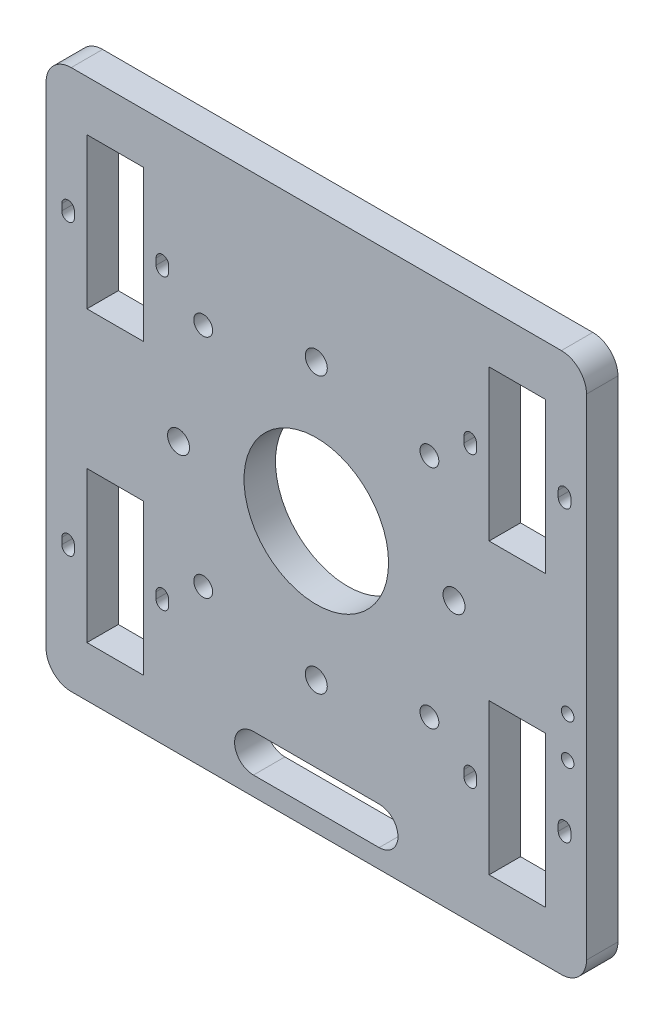
from build123d import *

# Parameters (mm, degrees)
SKETCH1_W           = 86
SKETCH1_H           = 86
SKETCH1_R           = 1.5
SKETCH1_R_2         = 11.5
SKETCH1_R_3         = 1.75
SKETCH1_W_2         = 9
SKETCH1_H_2         = 24
BOSS_EXTRUDE1_DEPTH = 5
FILLET1_R           = 4
SKETCH2_R           = 1
CUT_EXTRUDE1_DEPTH  = 122.725100123


with BuildPart() as part:
    # Sketch1 → Boss-Extrude1 (new body)
    with BuildSketch(Plane.XY):
        with Locations((43, 43)):
            Rectangle(SKETCH1_W, SKETCH1_H)
        with Locations((25, 61)):
            Circle(SKETCH1_R, mode=Mode.SUBTRACT)
        with Locations((61, 61)):
            Circle(SKETCH1_R, mode=Mode.SUBTRACT)
        with Locations((25, 25)):
            Circle(SKETCH1_R, mode=Mode.SUBTRACT)
        with Locations((61, 25)):
            Circle(SKETCH1_R, mode=Mode.SUBTRACT)
        with Locations((43, 43)):
            Circle(SKETCH1_R_2, mode=Mode.SUBTRACT)
        with Locations((43, 64.920310217)):
            Circle(SKETCH1_R_3, mode=Mode.SUBTRACT)
        with Locations((64.920310217, 43)):
            Circle(SKETCH1_R_3, mode=Mode.SUBTRACT)
        with Locations((43, 21.079689783)):
            Circle(SKETCH1_R_3, mode=Mode.SUBTRACT)
        with Locations((21.079689783, 43)):
            Circle(SKETCH1_R_3, mode=Mode.SUBTRACT)
        with Locations((75, 66)):
            Rectangle(SKETCH1_W_2, SKETCH1_H_2, mode=Mode.SUBTRACT)
        with BuildLine():
            Line((68.5, 66.5), (68.5, 65.5))
            ThreePointArc((68.5, 65.5), (67.5, 64.5), (66.5, 65.5))
            Line((66.5, 65.5), (66.5, 66.5))
            ThreePointArc((66.5, 66.5), (67.5, 67.5), (68.5, 66.5))
        make_face(mode=Mode.SUBTRACT)
        with BuildLine():
            Line((81.5, 66.5), (81.5, 65.5))
            ThreePointArc((81.5, 65.5), (82.5, 64.5), (83.5, 65.5))
            Line((83.5, 65.5), (83.5, 66.5))
            ThreePointArc((83.5, 66.5), (82.5, 67.5), (81.5, 66.5))
        make_face(mode=Mode.SUBTRACT)
        with BuildLine():
            Line((68.5, 19.5), (68.5, 20.5))
            ThreePointArc((68.5, 20.5), (67.5, 21.5), (66.5, 20.5))
            Line((66.5, 20.5), (66.5, 19.5))
            ThreePointArc((66.5, 19.5), (67.5, 18.5), (68.5, 19.5))
        make_face(mode=Mode.SUBTRACT)
        with BuildLine():
            Line((81.5, 19.5), (81.5, 20.5))
            ThreePointArc((81.5, 20.5), (82.5, 21.5), (83.5, 20.5))
            Line((83.5, 20.5), (83.5, 19.5))
            ThreePointArc((83.5, 19.5), (82.5, 18.5), (81.5, 19.5))
        make_face(mode=Mode.SUBTRACT)
        with Locations((75, 20)):
            Rectangle(SKETCH1_W_2, SKETCH1_H_2, mode=Mode.SUBTRACT)
        with BuildLine():
            Line((17.5, 66.5), (17.5, 65.5))
            ThreePointArc((17.5, 65.5), (18.5, 64.5), (19.5, 65.5))
            Line((19.5, 65.5), (19.5, 66.5))
            ThreePointArc((19.5, 66.5), (18.5, 67.5), (17.5, 66.5))
        make_face(mode=Mode.SUBTRACT)
        with BuildLine():
            Line((4.5, 66.5), (4.5, 65.5))
            ThreePointArc((4.5, 65.5), (3.5, 64.5), (2.5, 65.5))
            Line((2.5, 65.5), (2.5, 66.5))
            ThreePointArc((2.5, 66.5), (3.5, 67.5), (4.5, 66.5))
        make_face(mode=Mode.SUBTRACT)
        with BuildLine():
            Line((17.5, 19.5), (17.5, 20.5))
            ThreePointArc((17.5, 20.5), (18.5, 21.5), (19.5, 20.5))
            Line((19.5, 20.5), (19.5, 19.5))
            ThreePointArc((19.5, 19.5), (18.5, 18.5), (17.5, 19.5))
        make_face(mode=Mode.SUBTRACT)
        with BuildLine():
            Line((4.5, 19.5), (4.5, 20.5))
            ThreePointArc((4.5, 20.5), (3.5, 21.5), (2.5, 20.5))
            Line((2.5, 20.5), (2.5, 19.5))
            ThreePointArc((2.5, 19.5), (3.5, 18.5), (4.5, 19.5))
        make_face(mode=Mode.SUBTRACT)
        with Locations((11, 20)):
            Rectangle(SKETCH1_W_2, SKETCH1_H_2, mode=Mode.SUBTRACT)
        with Locations((11, 66)):
            Rectangle(SKETCH1_W_2, SKETCH1_H_2, mode=Mode.SUBTRACT)
    extrude(amount=BOSS_EXTRUDE1_DEPTH)

    # Fillet1
    fillet1_edges = [part.edges().sort_by_distance(p)[0] for p in [
        (0, 86, 2.5),
        (86, 86, 2.5),
        (86, 0, 2.5),
        (0, 0, 2.5),
    ]]
    fillet(fillet1_edges, radius=FILLET1_R)

    # Sketch2 → Cut-Extrude1 (cut, through all)
    with BuildSketch(Plane.XY.offset(5)):
        with Locations((83, 36.4)):
            Circle(SKETCH2_R)
        with Locations((83, 30)):
            Circle(SKETCH2_R)
        with BuildLine():
            Line((33, 9), (53, 9))
            ThreePointArc((53, 9), (56, 6), (53, 3))
            Line((53, 3), (33, 3))
            ThreePointArc((33, 3), (30, 6), (33, 9))
        make_face()
    extrude(amount=-CUT_EXTRUDE1_DEPTH, mode=Mode.SUBTRACT)


solid = part.part
